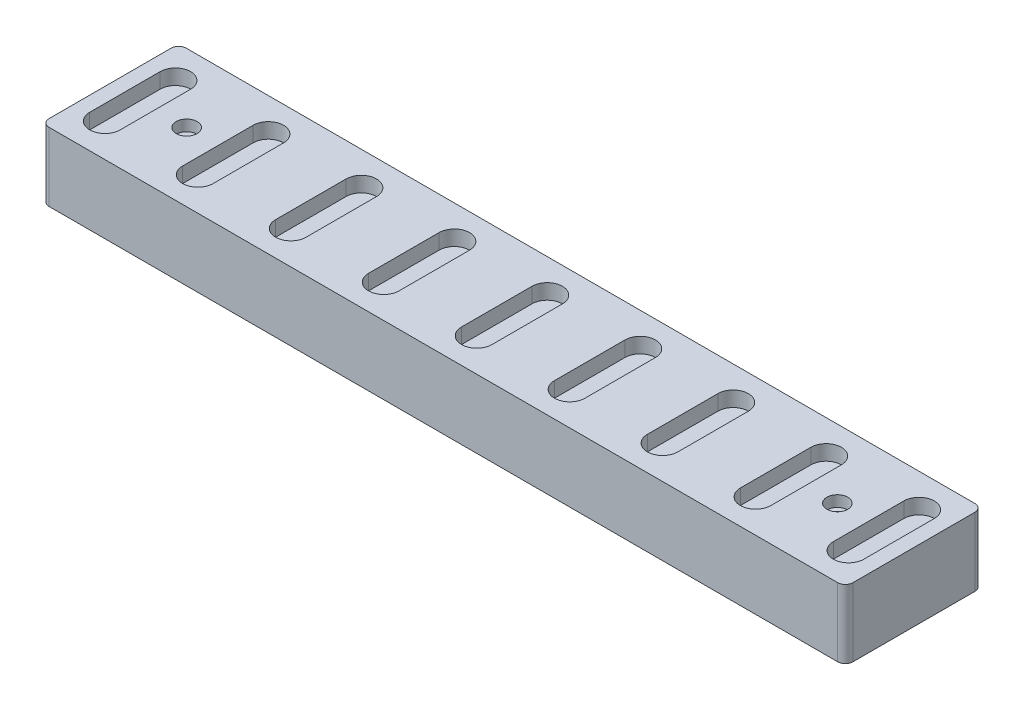
from build123d import *

# Parameters (mm, degrees)
SKETCH1_W                                         = 211
SKETCH1_H                                         = 36
BOSS_EXTRUDE1_DEPTH                               = 18
CUT_EXTRUDE1_DEPTH                                = 4
LPATTERN1_COUNT                                   = 9
LPATTERN1_PITCH                                   = 24.4
CBORE_FOR_M2_5_SOCKET_HEAD_CAP_SCREW1_D           = 2.9
CBORE_FOR_M2_5_SOCKET_HEAD_CAP_SCREW1_CBORE_D     = 5.5
CBORE_FOR_M2_5_SOCKET_HEAD_CAP_SCREW1_CBORE_DEPTH = 2.9
FILLET1_R                                         = 2


with BuildPart() as part:
    # Sketch1 → Boss-Extrude1 (new body)
    with BuildSketch(Plane(origin=(0, 0, 0), x_dir=(1, 0, 0), z_dir=(0, 1, 0))):
        Rectangle(SKETCH1_W, SKETCH1_H)
    extrude(amount=BOSS_EXTRUDE1_DEPTH)

    # Sketch2 → Cut-Extrude1 (cut)
    with BuildSketch(Plane(origin=(0, 18, 0), x_dir=(1, 0, 0), z_dir=(0, 1, 0))):
        with BuildLine():
            Line((-101.6, 9.25), (-101.6, -9.25))
            ThreePointArc((-101.6, -9.25), (-97.6, -13.25), (-93.6, -9.25))
            Line((-93.6, -9.25), (-93.6, 9.25))
            ThreePointArc((-93.6, 9.25), (-97.6, 13.25), (-101.6, 9.25))
        make_face()
    cut_extrude1 = extrude(amount=-CUT_EXTRUDE1_DEPTH, mode=Mode.SUBTRACT)

    # LPattern1: Cut-Extrude1 ×9
    with Locations(*[(i * LPATTERN1_PITCH, 0, 0) for i in range(1, LPATTERN1_COUNT)]):
        add(cut_extrude1, mode=Mode.SUBTRACT)

    # CBORE for M2.5 Socket Head Cap Screw1 (through all)
    with Locations(Plane(origin=(0, 18, 0), x_dir=(1, 0, 0), z_dir=(0, 1, 0))):
        with Locations((-85.4, 0), (85.4, 0)):
            CounterBoreHole(CBORE_FOR_M2_5_SOCKET_HEAD_CAP_SCREW1_D / 2, CBORE_FOR_M2_5_SOCKET_HEAD_CAP_SCREW1_CBORE_D / 2, CBORE_FOR_M2_5_SOCKET_HEAD_CAP_SCREW1_CBORE_DEPTH)

    # Fillet1
    fillet1_edges = [part.edges().sort_by_distance(p)[0] for p in [
        (105.5, 9, 18),
        (-105.5, 9, 18),
        (-105.5, 9, -18),
        (105.5, 9, -18),
    ]]
    fillet(fillet1_edges, radius=FILLET1_R)


solid = part.part
